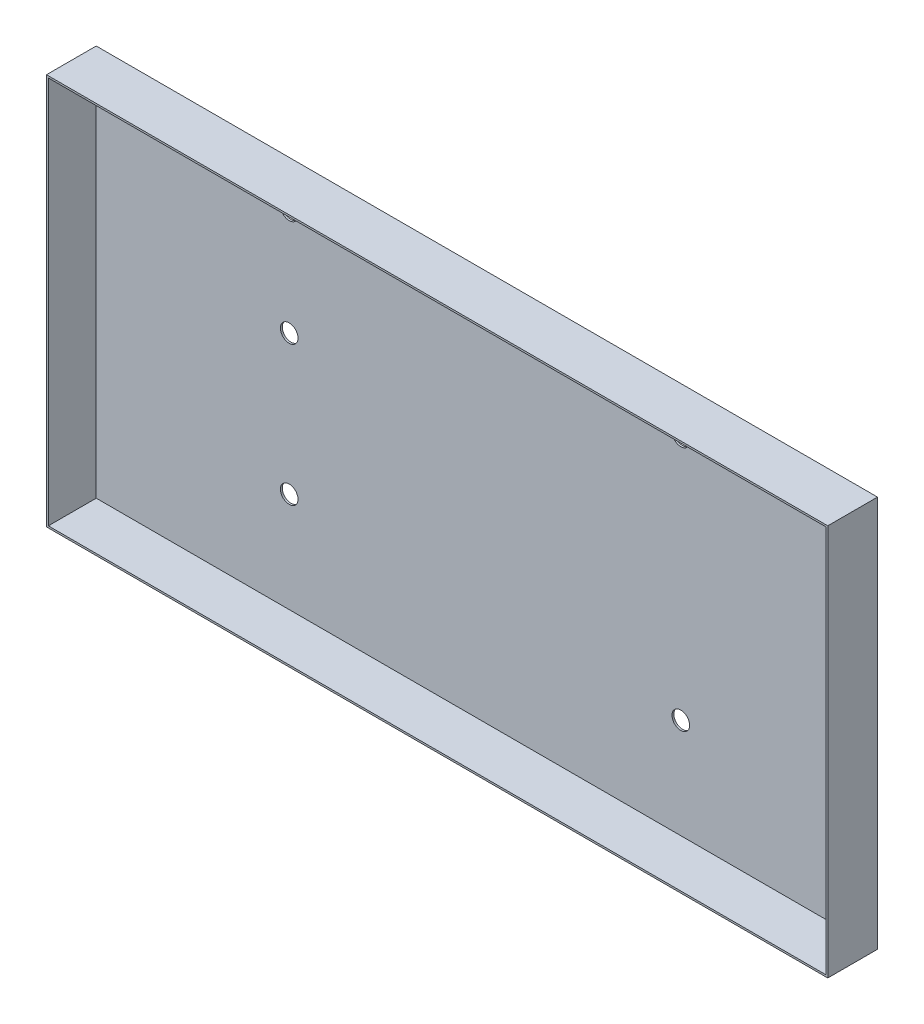
from build123d import *

# Parameters (mm, degrees)
CROQUIS1_W              = 798
CROQUIS1_H              = 400
CROQUIS1_R              = 9
SALIENTE_EXTRUIR1_DEPTH = 50.8
VACIADO1_T              = -1.9
CROQUIS2_W              = 794.2
CROQUIS2_H              = 396.2
CORTAR_EXTRUIR1_DEPTH   = 48.9


with BuildPart() as part:
    # Croquis1 → Saliente-Extruir1 (new body)
    with BuildSketch(Plane.XY):
        with Locations((-399, 200)):
            Rectangle(CROQUIS1_W, CROQUIS1_H)
        with Locations((-599, 355)):
            Circle(CROQUIS1_R, mode=Mode.SUBTRACT)
        with Locations((-599, 246.5)):
            Circle(CROQUIS1_R, mode=Mode.SUBTRACT)
        with Locations((-599, 104)):
            Circle(CROQUIS1_R, mode=Mode.SUBTRACT)
        with Locations((-199, 104)):
            Circle(CROQUIS1_R, mode=Mode.SUBTRACT)
        with Locations((-199, 355)):
            Circle(CROQUIS1_R, mode=Mode.SUBTRACT)
    extrude(amount=SALIENTE_EXTRUIR1_DEPTH)

    # Vaciado1
    vaciado1_openings = [part.faces().sort_by_distance(p)[0] for p in [
        (-398.839920182, 199.86833435, 50.8),
    ]]
    offset(amount=VACIADO1_T, openings=vaciado1_openings, kind=Kind.INTERSECTION)

    # Croquis2 → Cortar-Extruir1 (cut)
    with BuildSketch(Plane.XY.offset(50.8)):
        with Locations((-399, 200)):
            Rectangle(CROQUIS2_W, CROQUIS2_H)
    extrude(amount=-CORTAR_EXTRUIR1_DEPTH, mode=Mode.SUBTRACT)


solid = part.part
